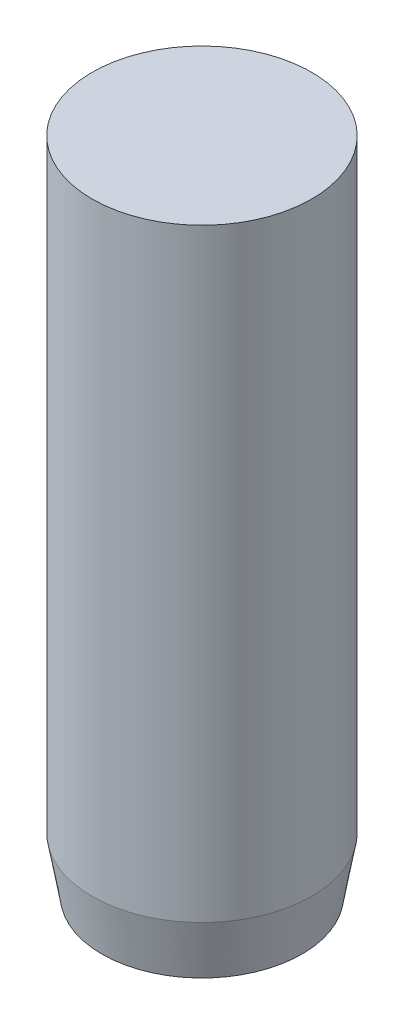
from build123d import *

# Parameters (mm, degrees)
SKETCH_1_R      = 2
EXTRUDE_1_DEPTH = 8
EXTRUDE_START   = -12
SKETCH_3_R      = 2
EXTRUDE_2_DEPTH = 12


with BuildPart() as part:
    # ｽｹｯﾁ1 → ﾎﾞｽ - 押し出し1 (new body)
    with BuildSketch(Plane(origin=(0, 0, 0), x_dir=(1, 0, 0), z_dir=(0, 1, 0))):
        with Locations(Location((0, 0, 0), (0, 0, 270))):
            Circle(SKETCH_1_R)
    extrude(amount=EXTRUDE_1_DEPTH)

    # ｽｹｯﾁ3 → ﾎﾞｽ - 押し出し2 (add)
    with BuildSketch(Plane(origin=(0, 8, 0), x_dir=(1, 0, 0), z_dir=(0, 1, 0)).offset(EXTRUDE_START)):
        with Locations(Location((0, 0, 0), (0, 0, 270))):
            Circle(SKETCH_3_R)
    extrude(amount=EXTRUDE_2_DEPTH)

    # ｽｹｯﾁ4 → ｶｯﾄ - 回転1 (revolve, cut)
    with BuildSketch(Plane(origin=(0, 0, 0), x_dir=(0, 0, -1), z_dir=(1, 0, 0)), mode=Mode.PRIVATE) as cut_revolve_1_sk:
        Polygon((1.823673019, -4), (2, -3), (2, -4), align=None)
    revolve(cut_revolve_1_sk.sketch.rotate(Axis((0, 0, 0), (0, -1, 0)), 180), axis=Axis((0, 0, 0), (0, -1, 0)), mode=Mode.SUBTRACT)


solid = part.part
